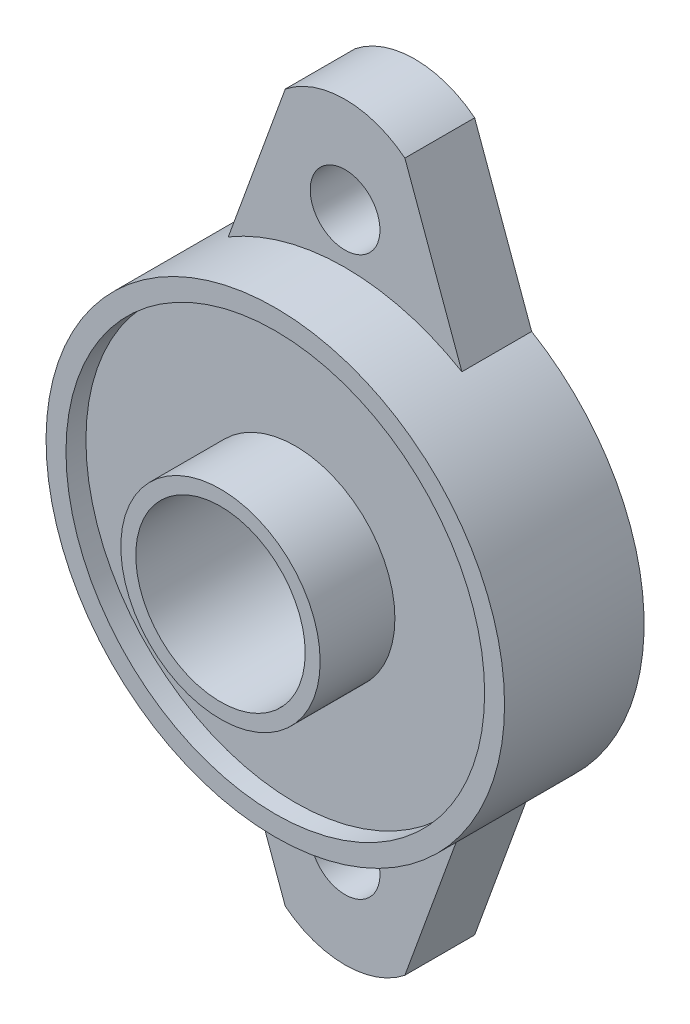
from build123d import *
from build123d.topology import SkipClean

# Parameters (mm, degrees)
ESQUISSE1_R             = 3.5
ESQUISSE1_R_2           = 8.5
BOSS_EXTRU_1_DEPTH      = 7
ESQUISSE2_R             = 23
ESQUISSE2_R_2           = 8.5
BOSS_EXTRU_2_DEPTH      = 7
ESQUISSE3_R             = 10
ESQUISSE3_R_2           = 8.5
BOSS_EXTRU_3_DEPTH      = 5.5
ENL_V_START             = -2
ESQUISSE4_R             = 21
ESQUISSE4_R_2           = 10
ENL_V_MAT_EXTRU_1_DEPTH = 2


with BuildPart() as part:
    # Esquisse1 → Boss.-Extru.1 (new body)
    with BuildSketch(Plane.XY):
        with BuildLine():
            Line((11.717444642, 19.791449948), (6, 35.5))
            ThreePointArc((6, 35.5), (0, 37.604686356), (-6, 35.5))
            Line((-6, 35.5), (-11.717444642, 19.791449948))
            ThreePointArc((-11.717444642, 19.791449948), (-23, 0), (-11.717444642, -19.791449948))
            Line((-11.717444642, -19.791449948), (-6, -35.5))
            ThreePointArc((-6, -35.5), (0, -37.604686356), (6, -35.5))
            Line((6, -35.5), (11.717444642, -19.791449948))
            ThreePointArc((11.717444642, -19.791449948), (23, 0), (11.717444642, 19.791449948))
        make_face()
        with Locations((0, 28)):
            Circle(ESQUISSE1_R, mode=Mode.SUBTRACT)
        Circle(ESQUISSE1_R_2, mode=Mode.SUBTRACT)
        with Locations(Location((0, -28, 0), (0, 0, 180))):
            Circle(ESQUISSE1_R, mode=Mode.SUBTRACT)
    extrude(amount=BOSS_EXTRU_1_DEPTH)

    # Esquisse2 → Boss.-Extru.2 (add)
    with BuildSketch(Plane.XY.offset(7)):
        with Locations(Location((0, 0, 0), (0, 0, 120.627475448))):
            Circle(ESQUISSE2_R)
        Circle(ESQUISSE2_R_2, mode=Mode.SUBTRACT)
    extrude(amount=BOSS_EXTRU_2_DEPTH)

    # Esquisse3 → Boss.-Extru.3 (add)
    with SkipClean():  # the faces are left unmerged after this step: merging them gives an invalid solid
        with BuildSketch(Plane.XY.offset(14)):
            Circle(ESQUISSE3_R)
            Circle(ESQUISSE3_R_2, mode=Mode.SUBTRACT)
        extrude(amount=BOSS_EXTRU_3_DEPTH)

    # Esquisse4 → Enlèv. mat.-Extru.1 (cut)
    with SkipClean():  # the faces are left unmerged after this step: merging them gives an invalid solid
        with BuildSketch(Plane.XY.offset(14).offset(ENL_V_START)):
            Circle(ESQUISSE4_R)
            Circle(ESQUISSE4_R_2, mode=Mode.SUBTRACT)
        extrude(amount=ENL_V_MAT_EXTRU_1_DEPTH, mode=Mode.SUBTRACT)


solid = part.part
